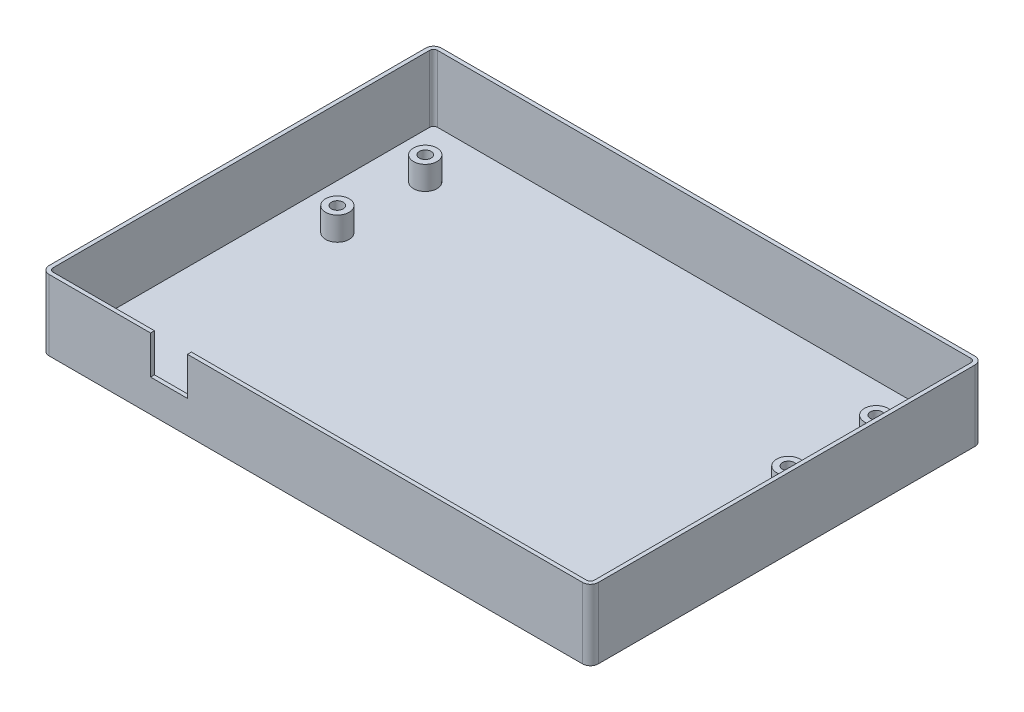
from build123d import *

# Parameters (mm, degrees)
BOSS_EXTRUDE1_DEPTH      = 15
BOSS_EXTRUDE1_DEPTH_BACK = 3
SHELL1_T                 = -1
SKETCH2_R                = 3
SKETCH2_R_2              = 1.5
BOSS_EXTRUDE2_DEPTH      = 6
SKETCH4_W                = 9.424257845
SKETCH4_H                = 10.522525497
CUT_EXTRUDE1_DEPTH       = 10


with BuildPart() as part:
    # Sketch1 → Boss-Extrude1 (new, two sides: drawn at the far end of the back side and taken through both)
    with BuildSketch(Plane(origin=(0, 0, 0), x_dir=(1, 0, 0), z_dir=(0, 1, 0)).offset(-BOSS_EXTRUDE1_DEPTH_BACK)):
        with BuildLine():
            Line((-68, -50), (68, -50))
            ThreePointArc((68, -50), (69.414213562, -49.414213562), (70, -48))
            Line((70, -48), (70, 48))
            ThreePointArc((70, 48), (69.414213562, 49.414213562), (68, 50))
            Line((68, 50), (-68, 50))
            ThreePointArc((-68, 50), (-69.414213562, 49.414213562), (-70, 48))
            Line((-70, 48), (-70, -48))
            ThreePointArc((-70, -48), (-69.414213562, -49.414213562), (-68, -50))
        make_face()
    extrude(amount=BOSS_EXTRUDE1_DEPTH + BOSS_EXTRUDE1_DEPTH_BACK)

    # Shell1
    shell1_openings = [part.faces().sort_by_distance(p)[0] for p in [
        (0, 15, 0),
    ]]
    offset(amount=SHELL1_T, openings=shell1_openings, kind=Kind.INTERSECTION)

    # Sketch2 → Boss-Extrude2 (add)
    # profile 1 of 4: a face of its own
    with BuildSketch(Plane(origin=(0, -2, 0), x_dir=(1, 0, 0), z_dir=(0, 1, 0))):
        with Locations(Location((-57.5, 35.380535612, 0), (0, 0, 270))):
            Circle(SKETCH2_R)
        with Locations(Location((-57.5, 35.380535612, 0), (0, 0, 270))):
            Circle(SKETCH2_R_2, mode=Mode.SUBTRACT)
    # profile 2 of 4: a face of its own
    with BuildSketch(Plane(origin=(0, -2, 0), x_dir=(1, 0, 0), z_dir=(0, 1, 0))):
        with Locations(Location((-57.5, 12.968164447, 0), (0, 0, 270))):
            Circle(SKETCH2_R)
        with Locations(Location((-57.5, 12.968164447, 0), (0, 0, 270))):
            Circle(SKETCH2_R_2, mode=Mode.SUBTRACT)
    # profile 3 of 4: a face of its own
    with BuildSketch(Plane(origin=(0, -2, 0), x_dir=(1, 0, 0), z_dir=(0, 1, 0))):
        with Locations(Location((57.5, 12.968164447, 0), (0, 0, 90))):
            Circle(SKETCH2_R)
        with Locations(Location((57.5, 12.968164447, 0), (0, 0, 90))):
            Circle(SKETCH2_R_2, mode=Mode.SUBTRACT)
    # profile 4 of 4: a face of its own
    with BuildSketch(Plane(origin=(0, -2, 0), x_dir=(1, 0, 0), z_dir=(0, 1, 0))):
        with Locations(Location((57.5, 35.380535612, 0), (0, 0, 90))):
            Circle(SKETCH2_R)
        with Locations(Location((57.5, 35.380535612, 0), (0, 0, 90))):
            Circle(SKETCH2_R_2, mode=Mode.SUBTRACT)
    extrude(amount=BOSS_EXTRUDE2_DEPTH)

    # Sketch4 → Cut-Extrude1 (cut)
    with BuildSketch(Plane.XY.offset(50)):
        with Locations((-37.455086441, 10.521410827)):
            Rectangle(SKETCH4_W, SKETCH4_H)
    extrude(amount=-CUT_EXTRUDE1_DEPTH, mode=Mode.SUBTRACT)


solid = part.part
